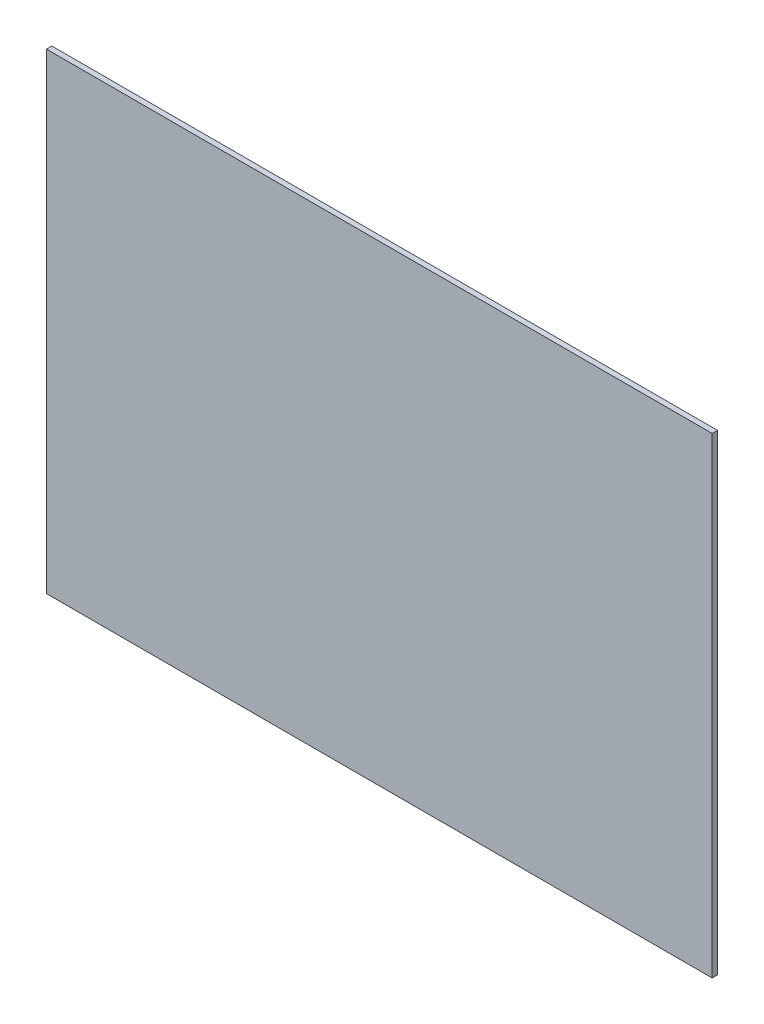
from build123d import *

# Parameters (mm, degrees)
SKETCH3_W           = 393.7
SKETCH3_H           = 278.892
BOSS_EXTRUDE1_DEPTH = 1.5875


with BuildPart() as part:
    # Sketch3 → Boss-Extrude1 (new, symmetric)
    with BuildSketch(Plane.XY):
        Rectangle(SKETCH3_W, SKETCH3_H)
    extrude(amount=BOSS_EXTRUDE1_DEPTH, both=True)


solid = part.part
